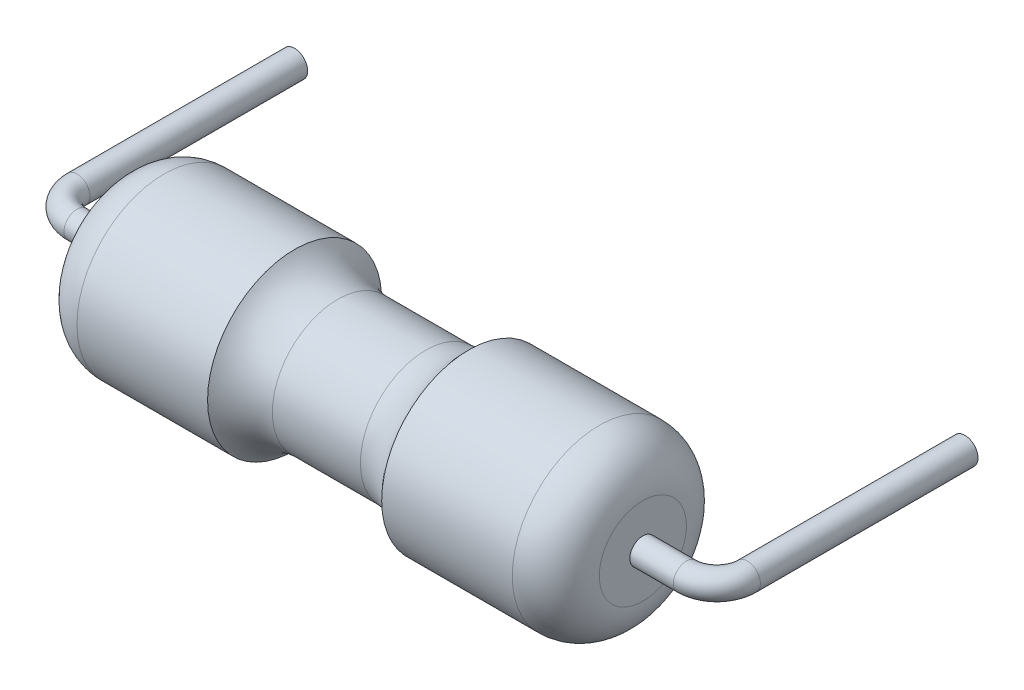
from build123d import *

# Parameters (mm, degrees)
SKETCH_2_R = 0.15


with BuildPart() as part:
    # 草图1 → 旋转1 (revolve)
    with BuildSketch(Plane.XY, mode=Mode.PRIVATE) as revolve_1_sk:
        with BuildLine():
            Line((3, 0.5), (3, 0))
            Line((3, 0), (-3, 0))
            Line((-3, 0), (-3, 0.5))
            ThreePointArc((-3, 0.5), (-2.853553391, 0.853553391), (-2.5, 1))
            Line((-2.5, 1), (-1, 1))
            ThreePointArc((-1, 1), (-0.780842208, 0.819581425), (-0.505634241, 0.75))
            Line((-0.505634241, 0.75), (0.505634241, 0.75))
            ThreePointArc((0.505634241, 0.75), (0.780842208, 0.819581425), (1, 1))
            Line((1, 1), (2.5, 1))
            ThreePointArc((2.5, 1), (2.853553391, 0.853553391), (3, 0.5))
        make_face()
    revolve(revolve_1_sk.sketch.rotate(Axis((-1000, 0, 0), (1, 0, 0)), 90), axis=Axis((-1000, 0, 0), (1, 0, 0)))

    # 扫描1: sweep along a path in 草图3
    with BuildLine(Plane(origin=(0, 0, 0), x_dir=(1, 0, 0), z_dir=(0, 1, 0))) as sweep_1_path:
        Line((3, -0.15), (3.5, -0.15))
        ThreePointArc((3.5, -0.15), (3.853553391, -0.003553391), (4, 0.35))
        Line((4, 0.35), (4, 2.85))
    # 草图2 → 扫描1 (sweep)
    with BuildSketch(Plane(origin=(3, 0, 0), x_dir=(0, 0, -1), z_dir=(1, 0, 0))):
        Circle(SKETCH_2_R)
    sweep_1 = sweep(path=sweep_1_path.line)

    # 镜向1: 扫描1 across plane
    add(sweep_1.mirror(Plane(origin=(0, 0, 0), x_dir=(0, 0, 1), z_dir=(1, 0, 0))))


solid = part.part
